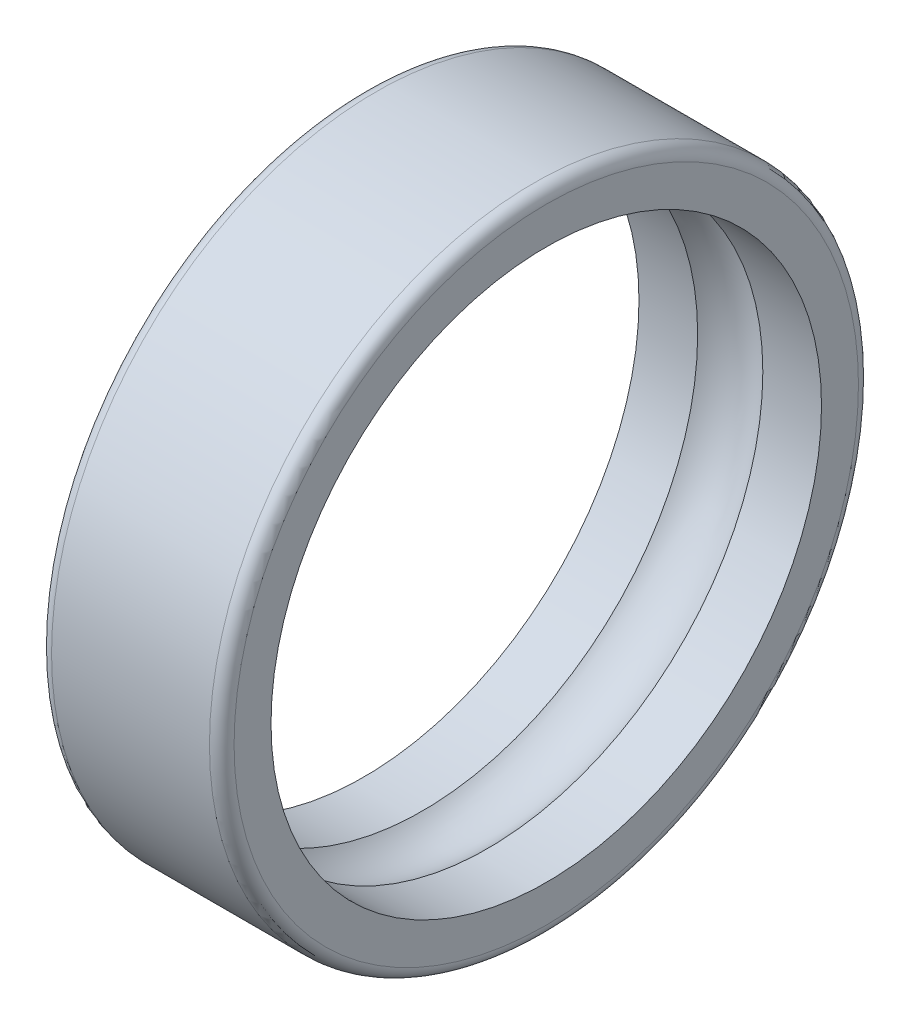
from build123d import *


with BuildPart() as part:
    # Esquisse1 → Base-Révolution (revolve)
    with BuildSketch(Plane.XY, mode=Mode.PRIVATE) as base_r_volution_sk:
        with BuildLine():
            Line((-3.892857143, 16), (3.892857143, 16))
            ThreePointArc((3.892857143, 16), (4.322171974, 15.822171974), (4.5, 15.392857143))
            Line((4.5, 15.392857143), (4.5, 13.571428571))
            Line((4.5, 13.571428571), (1.60634901, 13.571428571))
            ThreePointArc((1.60634901, 13.571428571), (0, 14.178571429), (-1.60634901, 13.571428571))
            Line((-1.60634901, 13.571428571), (-4.5, 13.571428571))
            Line((-4.5, 13.571428571), (-4.5, 15.392857143))
            ThreePointArc((-4.5, 15.392857143), (-4.322171974, 15.822171974), (-3.892857143, 16))
        make_face()
    revolve(base_r_volution_sk.sketch.rotate(Axis((0, 0, 0), (1, 0, 0)), 90), axis=Axis((0, 0, 0), (1, 0, 0)))


solid = part.part
